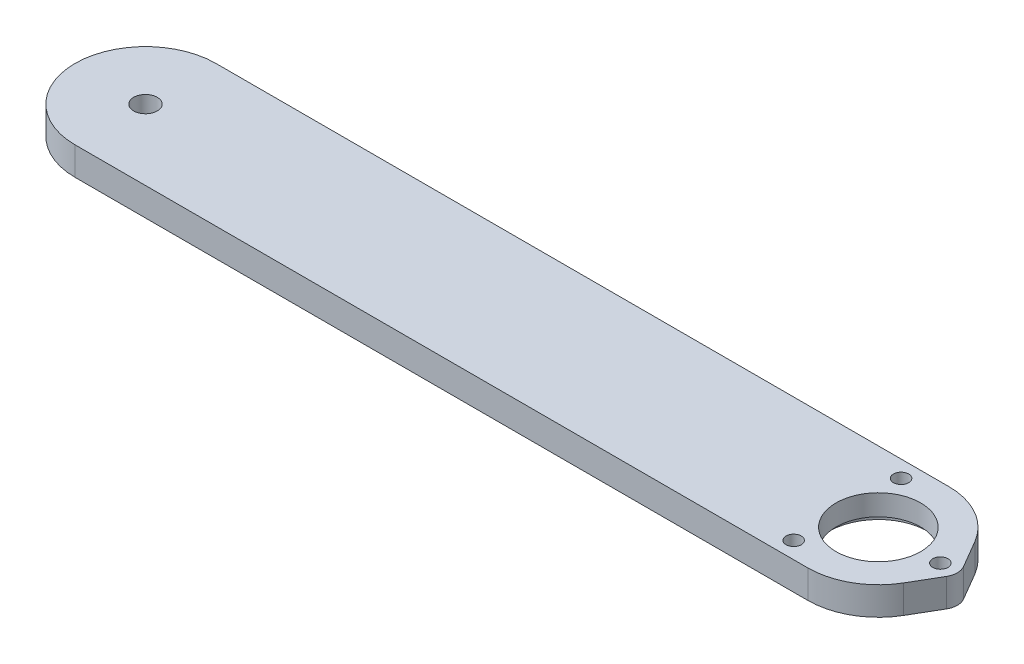
from build123d import *

# Parameters (mm, degrees)
EXTRUDE_1_DEPTH     = 5
EXTRUDE_5_DEPTH     = 5
CUT_EXTRUDE_2_REACH = 82.139
SKETCH_7_R          = 7.5
SKETCH_8_R          = 8.75
CUT_EXTRUDE_3_DEPTH = 1.3
CUT_EXTRUDE_4_REACH = 82.139
SKETCH_9_R          = 1.35
CUT_EXTRUDE_5_REACH = 82.139
SKETCH_12_R         = 2.1


with BuildPart() as part:
    # 草图1 → 凸台-拉伸1 (new body)
    with BuildSketch(Plane(origin=(0, 0, 0), x_dir=(1, 0, 0), z_dir=(0, 1, 0))):
        with BuildLine():
            Line((-65, 12.5), (65, 12.5))
            ThreePointArc((65, 12.5), (77.5, 0), (65, -12.5))
            Line((65, -12.5), (-65, -12.5))
            ThreePointArc((-65, -12.5), (-77.5, 0), (-65, 12.5))
        make_face()
    extrude(amount=EXTRUDE_1_DEPTH)

    # 草图10 → 凸台-拉伸5 (add)
    with BuildSketch(Plane.XZ):
        with BuildLine():
            Line((75.795454545, -6.301441197), (78.590909091, -1.512345887))
            ThreePointArc((78.590909091, -1.512345887), (79, 0), (78.590909091, 1.512345887))
            Line((78.590909091, 1.512345887), (75.795454545, 6.301441197))
            Line((75.795454545, 6.301441197), (75.795454545, -6.301441197))
        make_face()
    extrude(amount=-EXTRUDE_5_DEPTH)

    # 草图7 → 切除-拉伸2 (cut, up to next)
    with BuildSketch(Plane(origin=(0, 5, 0), x_dir=(1, 0, 0), z_dir=(0, 1, 0)), mode=Mode.PRIVATE) as cut_extrude_2_sk1:
        with Locations(Location((65, 0, 0), (0, 0, 270))):
            Circle(SKETCH_7_R)
    cut_extrude_2_tool1 = extrude(cut_extrude_2_sk1.sketch, amount=-CUT_EXTRUDE_2_REACH, mode=Mode.PRIVATE) & part.part
    add(cut_extrude_2_tool1.solids().sort_by_distance((65, 5, 0))[0], mode=Mode.SUBTRACT)

    # 草图8 → 切除-拉伸3 (cut)
    with BuildSketch(Plane(origin=(0, 0, 0), x_dir=(1, 0, 0), z_dir=(0, 1, 0))):
        with Locations(Location((65, 0, 0), (0, 0, 270))):
            Circle(SKETCH_8_R)
    extrude(amount=CUT_EXTRUDE_3_DEPTH, mode=Mode.SUBTRACT)

    # 草图9 → 切除-拉伸4 (cut, up to next)
    with BuildSketch(Plane.XZ, mode=Mode.PRIVATE) as cut_extrude_4_sk1:
        with Locations(Location((59.5, 9.526279442, 0), (0, 0, 270))):
            Circle(SKETCH_9_R)
    cut_extrude_4_tool1 = extrude(cut_extrude_4_sk1.sketch, amount=-CUT_EXTRUDE_4_REACH, mode=Mode.PRIVATE) & part.part
    # 草图9 → 切除-拉伸4 (cut, up to next)
    with BuildSketch(Plane.XZ, mode=Mode.PRIVATE) as cut_extrude_4_sk2:
        with Locations(Location((76, 0, 0), (0, 0, 270))):
            Circle(SKETCH_9_R)
    cut_extrude_4_tool2 = extrude(cut_extrude_4_sk2.sketch, amount=-CUT_EXTRUDE_4_REACH, mode=Mode.PRIVATE) & part.part
    # 草图9 → 切除-拉伸4 (cut, up to next)
    with BuildSketch(Plane.XZ, mode=Mode.PRIVATE) as cut_extrude_4_sk3:
        with Locations(Location((59.5, -9.526279442, 0), (0, 0, 270))):
            Circle(SKETCH_9_R)
    cut_extrude_4_tool3 = extrude(cut_extrude_4_sk3.sketch, amount=-CUT_EXTRUDE_4_REACH, mode=Mode.PRIVATE) & part.part
    add(cut_extrude_4_tool1.solids().sort_by_distance((59.5, 0, 9.526279))[0], mode=Mode.SUBTRACT)
    add(cut_extrude_4_tool2.solids().sort_by_distance((76, 0, 0))[0], mode=Mode.SUBTRACT)
    add(cut_extrude_4_tool3.solids().sort_by_distance((59.5, 0, -9.526279))[0], mode=Mode.SUBTRACT)

    # 草图12 → 切除-拉伸5 (cut, up to next)
    with BuildSketch(Plane(origin=(0, 5, 0), x_dir=(1, 0, 0), z_dir=(0, 1, 0)), mode=Mode.PRIVATE) as cut_extrude_5_sk1:
        with Locations(Location((-65, 0, 0), (0, 0, 270))):
            Circle(SKETCH_12_R)
    cut_extrude_5_tool1 = extrude(cut_extrude_5_sk1.sketch, amount=-CUT_EXTRUDE_5_REACH, mode=Mode.PRIVATE) & part.part
    add(cut_extrude_5_tool1.solids().sort_by_distance((-65, 5, 0))[0], mode=Mode.SUBTRACT)


solid = part.part
